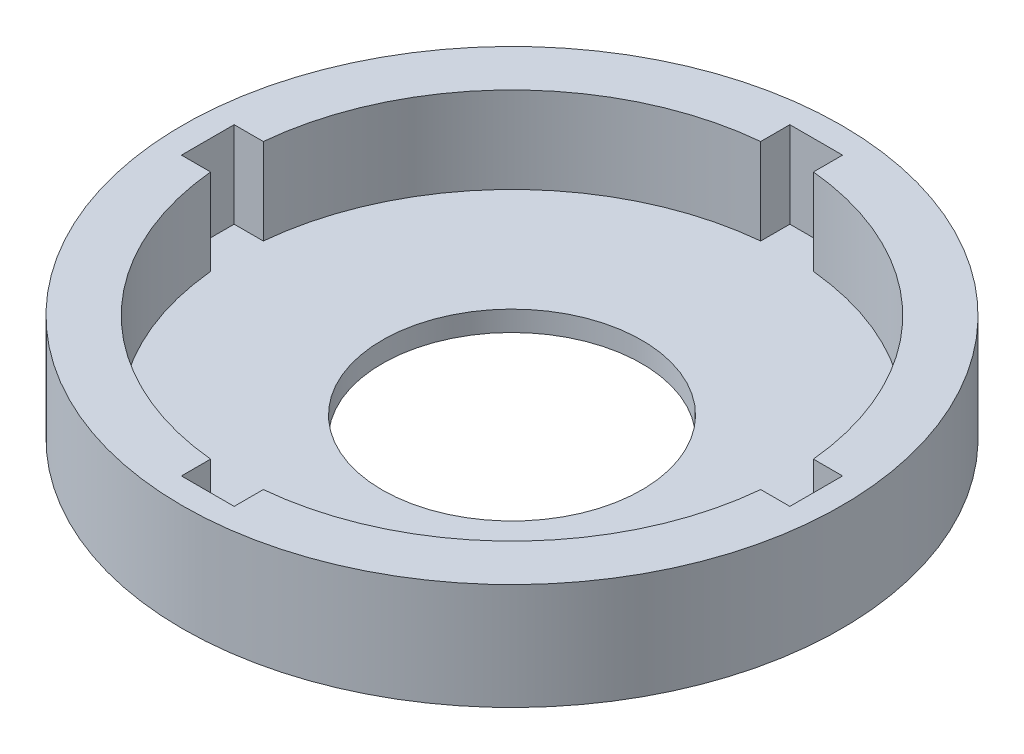
from build123d import *

# Parameters (mm, degrees)
SKETCH1_R           = 32.5
SKETCH1_R_2         = 12.8
BOSS_EXTRUDE1_DEPTH = 2
SKETCH2_R           = 32.5
BOSS_EXTRUDE2_DEPTH = 8.5


with BuildPart() as part:
    # Sketch1 → Boss-Extrude1 (new body)
    with BuildSketch(Plane(origin=(0, 0, 0), x_dir=(1, 0, 0), z_dir=(0, 1, 0))):
        with Locations(Location((0, 0, 0), (0, 0, 270))):
            Circle(SKETCH1_R)
        with Locations(Location((0, 0, 0), (0, 0, 270))):
            Circle(SKETCH1_R_2, mode=Mode.SUBTRACT)
    extrude(amount=BOSS_EXTRUDE1_DEPTH)

    # Sketch2 → Boss-Extrude2 (add)
    with BuildSketch(Plane(origin=(0, 2, 0), x_dir=(1, 0, 0), z_dir=(0, 1, 0))):
        with Locations(Location((0, 0, 0), (0, 0, 270))):
            Circle(SKETCH2_R)
        with BuildLine():
            Line((2.6, -27.125679715), (2.6, -30))
            Line((2.6, -30), (-2.6, -30))
            Line((-2.6, -30), (-2.6, -27.125679715))
            ThreePointArc((-2.6, -27.125679715), (-19.268659787, -19.268659787), (-27.125679715, -2.6))
            Line((-27.125679715, -2.6), (-30, -2.6))
            Line((-30, -2.6), (-30, 2.6))
            Line((-30, 2.6), (-27.125679715, 2.6))
            ThreePointArc((-27.125679715, 2.6), (-19.268659787, 19.268659787), (-2.6, 27.125679715))
            Line((-2.6, 27.125679715), (-2.6, 30))
            Line((-2.6, 30), (2.6, 30))
            Line((2.6, 30), (2.6, 27.125679715))
            ThreePointArc((2.6, 27.125679715), (19.268659787, 19.268659787), (27.125679715, 2.6))
            Line((27.125679715, 2.6), (30, 2.6))
            Line((30, 2.6), (30, -2.6))
            Line((30, -2.6), (27.125679715, -2.6))
            ThreePointArc((27.125679715, -2.6), (19.268659787, -19.268659787), (2.6, -27.125679715))
        make_face(mode=Mode.SUBTRACT)
    extrude(amount=BOSS_EXTRUDE2_DEPTH)


solid = part.part
